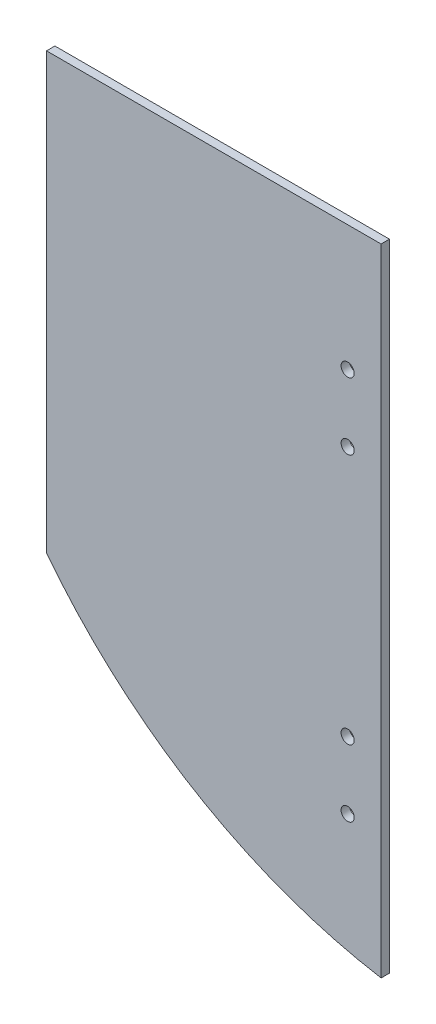
from build123d import *

# Parameters (mm, degrees)
SKETCH1_W                  = 241.3
SKETCH1_H                  = 127
BOSS_EXTRUDE1_DEPTH        = 3.175
F_9_0_196_DIAMETER_HOLE1_D = 4.9784
CUT_EXTRUDE1_DEPTH         = 137.377245628


with BuildPart() as part:
    # Sketch1 → Boss-Extrude1 (new body)
    with BuildSketch(Plane(origin=(0, 0, 0), x_dir=(0, 1, 0), z_dir=(0, 0, 1))):
        Rectangle(SKETCH1_W, SKETCH1_H)
    extrude(amount=BOSS_EXTRUDE1_DEPTH)

    # #9 (0.196) Diameter Hole1 (through all)
    with Locations(Plane.XY.offset(3.175)):
        with Locations((50.8, 73.025), (50.8, -73.025), (50.8, -47.625), (50.8, 47.625)):
            Hole(F_9_0_196_DIAMETER_HOLE1_D / 2)

    # Sketch4 → Cut-Extrude1 (cut, through all)
    with BuildSketch(Plane.XY.offset(3.175)):
        with BuildLine():
            Line((-63.5, -44.45), (-63.5, -120.65))
            Line((-63.5, -120.65), (63.5, -120.65))
            ThreePointArc((63.5, -120.65), (-7.189698378, -94.53283063), (-63.5, -44.45))
        make_face()
    extrude(amount=-CUT_EXTRUDE1_DEPTH, mode=Mode.SUBTRACT)


solid = part.part
